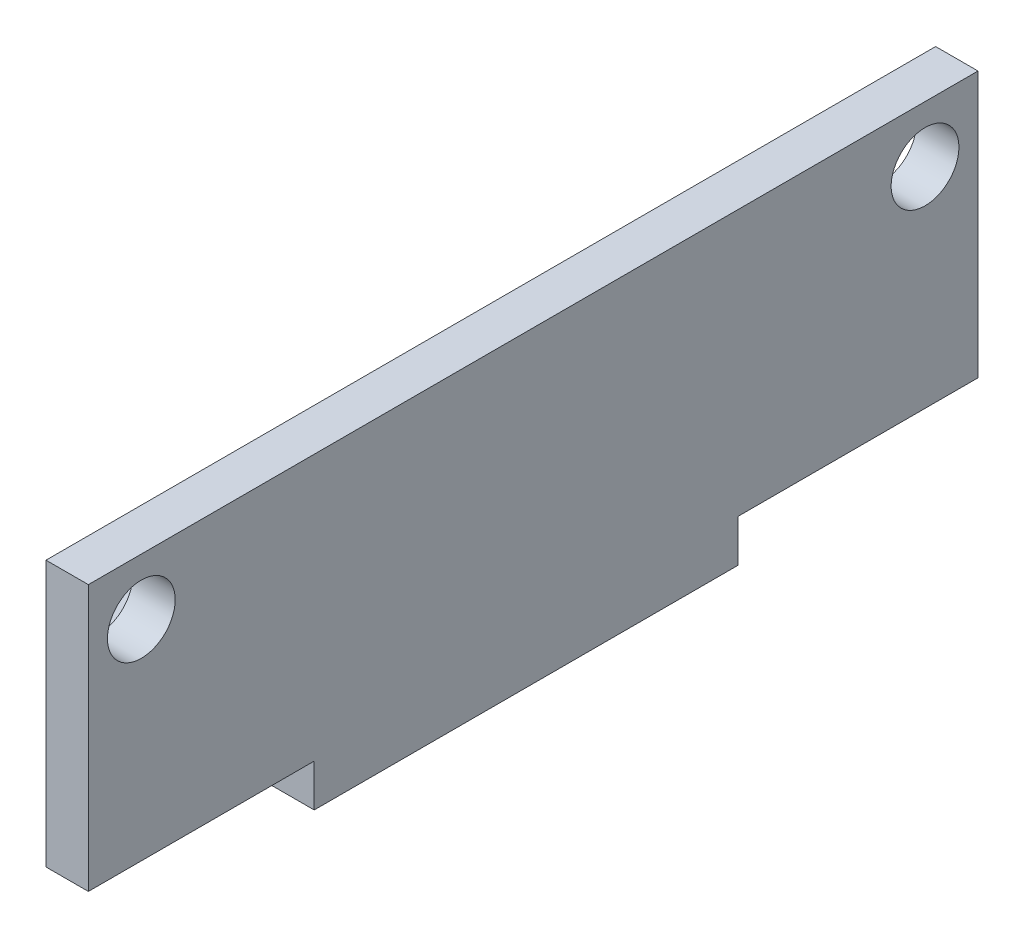
from build123d import *

# Parameters (mm, degrees)
SKETCH_1_W          = 12
SKETCH_1_H          = 20
EXTRUDE_1_DEPTH     = 2
SKETCH_2_W          = 2
SKETCH_2_H          = 11.337676179
SKETCH_2_H_2        = 20
SKETCH_2_H_3        = 10.662323821
EXTRUDE_3_DEPTH     = 20
SKETCH_5_R          = 1.6
SKETCH_5_W          = 42
SKETCH_5_H          = 7.454575948
CUT_EXTRUDE_1_DEPTH = 20
SKETCH_6_R          = 1.6
CUT_EXTRUDE_2_DEPTH = 10


with BuildPart() as part:
    # 草图1 → 凸台-拉伸1 (new body)
    with BuildSketch(Plane(origin=(0, 0, 0), x_dir=(1, 0, 0), z_dir=(0, 1, 0))):
        Rectangle(SKETCH_1_W, SKETCH_1_H)
    extrude(amount=EXTRUDE_1_DEPTH)

    # 草图2 → 凸台-拉伸3 (add)
    with BuildSketch(Plane(origin=(0, 2, 0), x_dir=(1, 0, 0), z_dir=(0, 1, 0))):
        with Locations((5, 15.66883809)):
            Rectangle(SKETCH_2_W, SKETCH_2_H)
        with Locations((5, 0)):
            Rectangle(SKETCH_2_W, SKETCH_2_H_2)
        with Locations((5, -15.331161911)):
            Rectangle(SKETCH_2_W, SKETCH_2_H_3)
    extrude(amount=EXTRUDE_3_DEPTH)

    # 草图5 → 切除-拉伸1 (cut)
    with BuildSketch(Plane(origin=(6, 0, 0), x_dir=(0, 0, -1), z_dir=(1, 0, 0))):
        with Locations((-18.162323821, 11.882323557)):
            Circle(SKETCH_5_R)
        with Locations((18.837676179, 11.882323557)):
            Circle(SKETCH_5_R)
        with Locations((0.337676179, 18.272712026)):
            Rectangle(SKETCH_5_W, SKETCH_5_H)
    extrude(amount=-CUT_EXTRUDE_1_DEPTH, mode=Mode.SUBTRACT)

    # 草图6 → 切除-拉伸2 (cut)
    with BuildSketch(Plane(origin=(0, 2, 0), x_dir=(1, 0, 0), z_dir=(0, 1, 0))):
        with Locations(Location((-2.620398145, 5, 0), (0, 0, 270))):
            Circle(SKETCH_6_R)
        with Locations(Location((-2.620398145, -5, 0), (0, 0, 270))):
            Circle(SKETCH_6_R)
    extrude(amount=-CUT_EXTRUDE_2_DEPTH, mode=Mode.SUBTRACT)


solid = part.part
